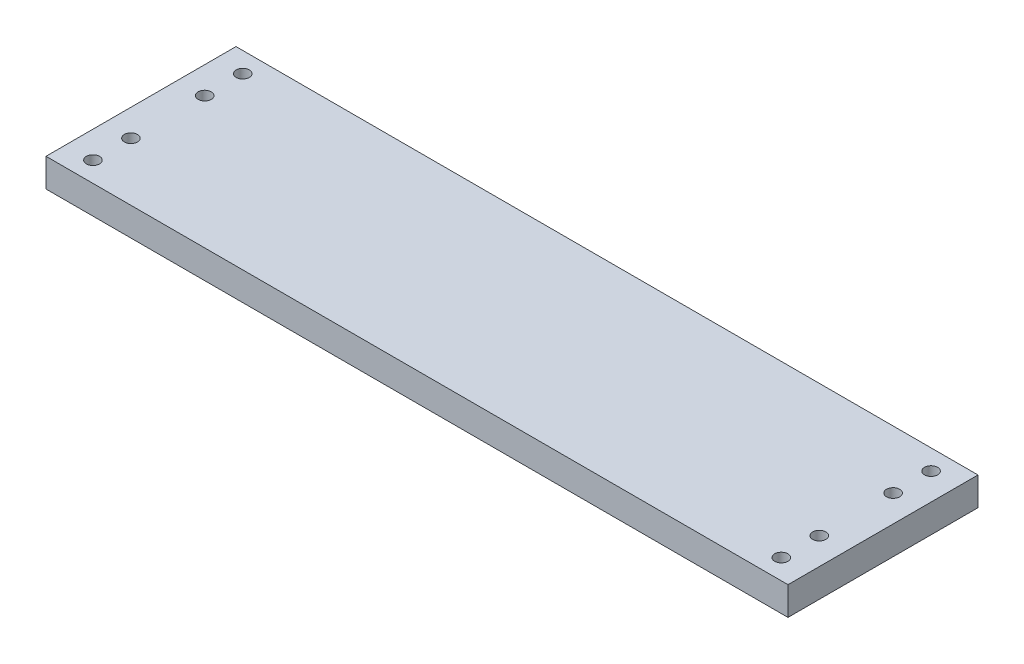
from build123d import *

# Parameters (mm, degrees)
SKETCH1_W                                         = 166
SKETCH1_H                                         = 42.51
BOSS_EXTRUDE1_DEPTH                               = 6.35
F_4_CLEARANCE_HOLE1_D                             = 2.9464
CSK_FOR_4_FLAT_HEAD_SOCKET_CAP_SCREW1_D           = 2.9464
CSK_FOR_4_FLAT_HEAD_SOCKET_CAP_SCREW1_CSINK_D     = 7.8017878
CSK_FOR_4_FLAT_HEAD_SOCKET_CAP_SCREW1_CSINK_ANGLE = 82


with BuildPart() as part:
    # Sketch1 → Boss-Extrude1 (new body)
    with BuildSketch(Plane(origin=(0, 0, 0), x_dir=(1, 0, 0), z_dir=(0, 1, 0))):
        Rectangle(SKETCH1_W, SKETCH1_H)
    extrude(amount=BOSS_EXTRUDE1_DEPTH)

    # #4 Clearance Hole1 (through all)
    with Locations(Plane(origin=(0, 6.35, 0), x_dir=(1, 0, 0), z_dir=(0, 1, 0))):
        with Locations((-77, 8.255), (-77, 16.755), (77, 8.255), (77, 16.755)):
            Hole(F_4_CLEARANCE_HOLE1_D / 2)

    # CSK for #4 Flat Head Socket Cap Screw1 (through all)
    with Locations(Plane(origin=(0, 0, 0), x_dir=(-1, 0, 0), z_dir=(0, -1, 0))):
        with Locations((77, 8.255), (77, 16.755), (-77, 8.255), (-77, 16.755)):
            csk_for_4_flat_head_socket_cap_screw1 = CounterSinkHole(CSK_FOR_4_FLAT_HEAD_SOCKET_CAP_SCREW1_D / 2, CSK_FOR_4_FLAT_HEAD_SOCKET_CAP_SCREW1_CSINK_D / 2, counter_sink_angle=CSK_FOR_4_FLAT_HEAD_SOCKET_CAP_SCREW1_CSINK_ANGLE)

    # Mirror1: CSK for #4 Flat Head Socket Cap Screw1 across plane
    add(csk_for_4_flat_head_socket_cap_screw1.mirror(Plane.XY), mode=Mode.SUBTRACT)


solid = part.part
